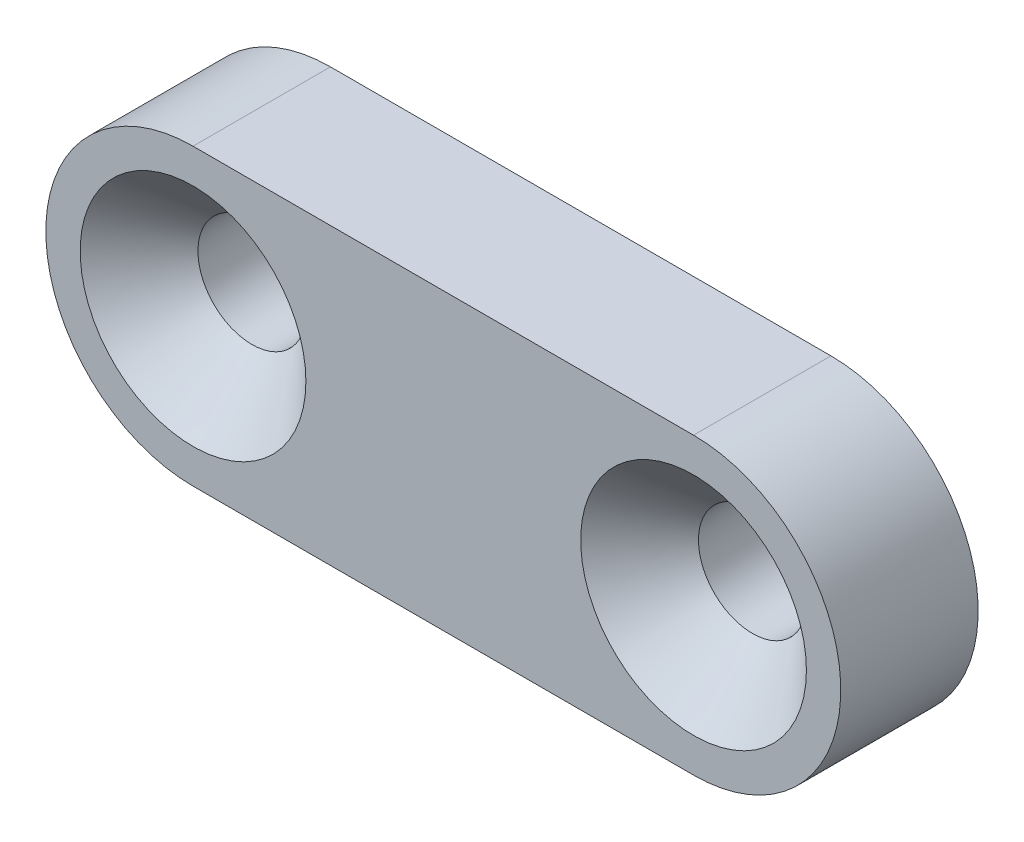
from build123d import *

# Parameters (mm, degrees)
ESQUISSE1_R        = 2.75
BOSS_EXTRU_1_DEPTH = 7
CHANFREIN1_SIZE    = 3


with BuildPart() as part:
    # Esquisse1 → Boss.-Extru.1 (new body)
    with BuildSketch(Plane.XY):
        with BuildLine():
            Line((0, -7.5), (25.5, -7.5))
            ThreePointArc((25.5, -7.5), (33, 0), (25.5, 7.5))
            Line((25.5, 7.5), (0, 7.5))
            ThreePointArc((0, 7.5), (-7.5, 0), (0, -7.5))
        make_face()
        Circle(ESQUISSE1_R, mode=Mode.SUBTRACT)
        with Locations((25.5, 0)):
            Circle(ESQUISSE1_R, mode=Mode.SUBTRACT)
    extrude(amount=BOSS_EXTRU_1_DEPTH)

    # Chanfrein1
    chanfrein1_edges = [part.edges().sort_by_distance(p)[0] for p in [
        (-2.75, 0, 7),
        (22.75, 0, 7),
    ]]
    chamfer(chanfrein1_edges, length=CHANFREIN1_SIZE)


solid = part.part
